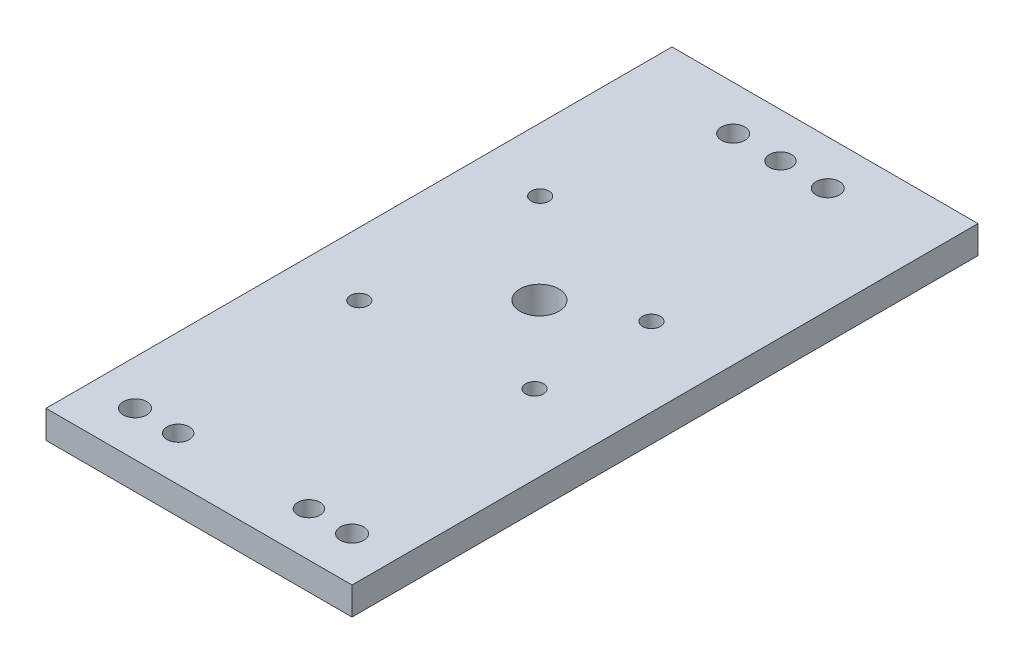
from build123d import *

# Parameters (mm, degrees)
SKETCH1_W             = 110
SKETCH1_H             = 225
BOSS_EXTRUDE1_DEPTH   = 10
M8_CLEARANCE_HOLE1_D  = 8.4
F_8_0MM_DOWEL_HOLE1_D = 8
CUT_EXTRUDE1_REACH    = 127.623
SKETCH8_R             = 7
M6_CLEARANCE_HOLE1_D  = 6.4


with BuildPart() as part:
    # Sketch1 → Boss-Extrude1 (new body)
    with BuildSketch(Plane(origin=(0, 0, 0), x_dir=(1, 0, 0), z_dir=(0, 1, 0))):
        Rectangle(SKETCH1_W, SKETCH1_H)
    extrude(amount=-BOSS_EXTRUDE1_DEPTH)

    # M8 Clearance Hole1 (through all)
    with Locations(Plane(origin=(0, 0, 0), x_dir=(1, 0, 0), z_dir=(0, 1, 0))):
        with Locations((-17, 96.5), (17, 96.5), (-39, -96.5), (39, -96.5)):
            Hole(M8_CLEARANCE_HOLE1_D / 2)

    # Ø8.0mm Dowel Hole1 (through all)
    with Locations(Plane(origin=(0, 0, 0), x_dir=(1, 0, 0), z_dir=(0, 1, 0))):
        with Locations((0, 96.5), (-23.5, -96.5), (23.5, -96.5)):
            Hole(F_8_0MM_DOWEL_HOLE1_D / 2)

    # Sketch8 → Cut-Extrude1 (cut, up to next)
    with BuildSketch(Plane(origin=(0, 0, 0), x_dir=(1, 0, 0), z_dir=(0, 1, 0)), mode=Mode.PRIVATE) as cut_extrude1_sk1:
        with Locations(Location((0, 9.86, 0), (0, 0, 270))):
            Circle(SKETCH8_R)
    cut_extrude1_tool1 = extrude(cut_extrude1_sk1.sketch, amount=-CUT_EXTRUDE1_REACH, mode=Mode.PRIVATE) & part.part
    add(cut_extrude1_tool1.solids().sort_by_distance((0, 0, -9.86))[0], mode=Mode.SUBTRACT)

    # M6 Clearance Hole1 (through all)
    with Locations(Plane(origin=(0, 0, 0), x_dir=(1, 0, 0), z_dir=(0, 1, 0))):
        with Locations((26.75, 23.36), (26.75, -18.64), (-32.25, 42.36), (-32.25, -22.64)):
            Hole(M6_CLEARANCE_HOLE1_D / 2)


solid = part.part
